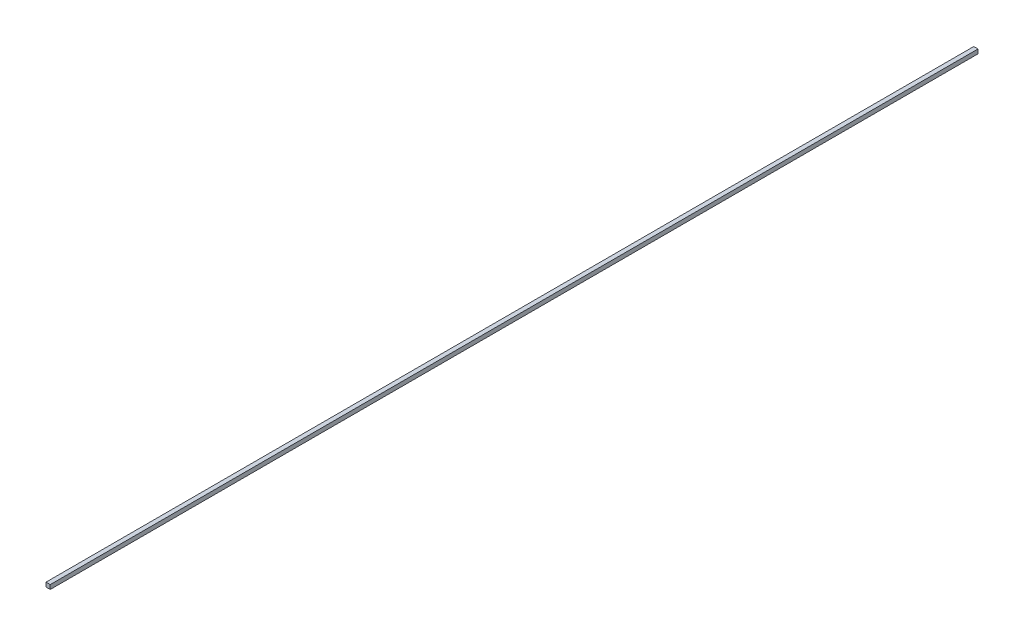
from build123d import *

# Parameters (mm, degrees)
SKETCH_1_W      = 3
SKETCH_1_H      = 3
EXTRUDE_1_DEPTH = 655


with BuildPart() as part:
    # 草图1 → 凸台-拉伸1 (new body)
    with BuildSketch(Plane.XY):
        with Locations((1.5, 1.5)):
            Rectangle(SKETCH_1_W, SKETCH_1_H)
    extrude(amount=EXTRUDE_1_DEPTH)


solid = part.part
